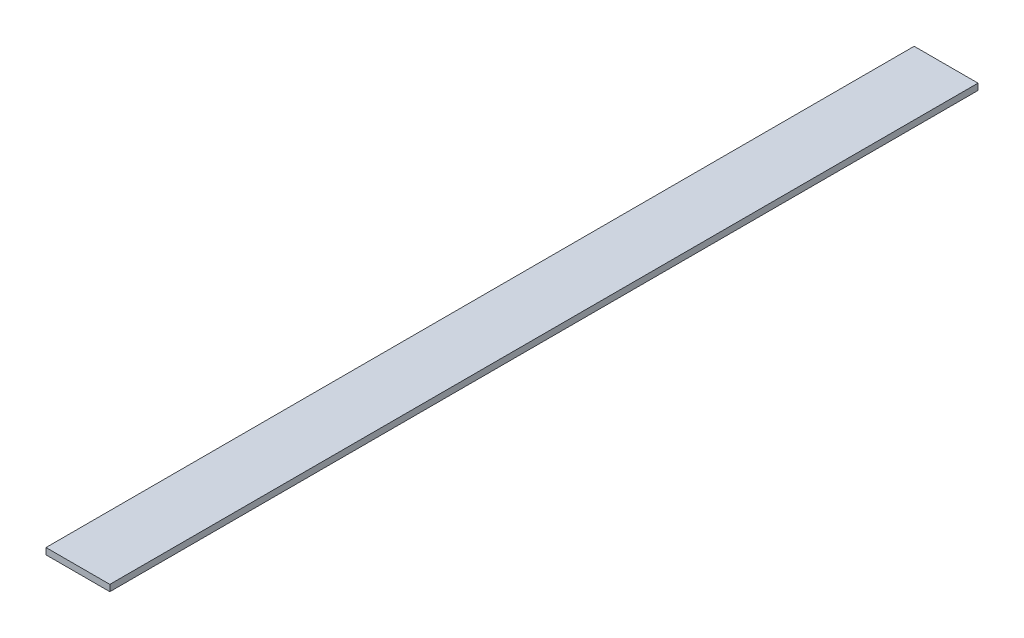
from build123d import *

# Parameters (mm, degrees)
SZKIC1_W                    = 50
SZKIC1_H                    = 5
DODANIE_WYCI_GNI_CIE1_DEPTH = 680


with BuildPart() as part:
    # Szkic1 → Dodanie-wyciągnięcie1 (new body)
    with BuildSketch(Plane.XY):
        with Locations((25, 2.5)):
            Rectangle(SZKIC1_W, SZKIC1_H)
    extrude(amount=DODANIE_WYCI_GNI_CIE1_DEPTH)


solid = part.part
